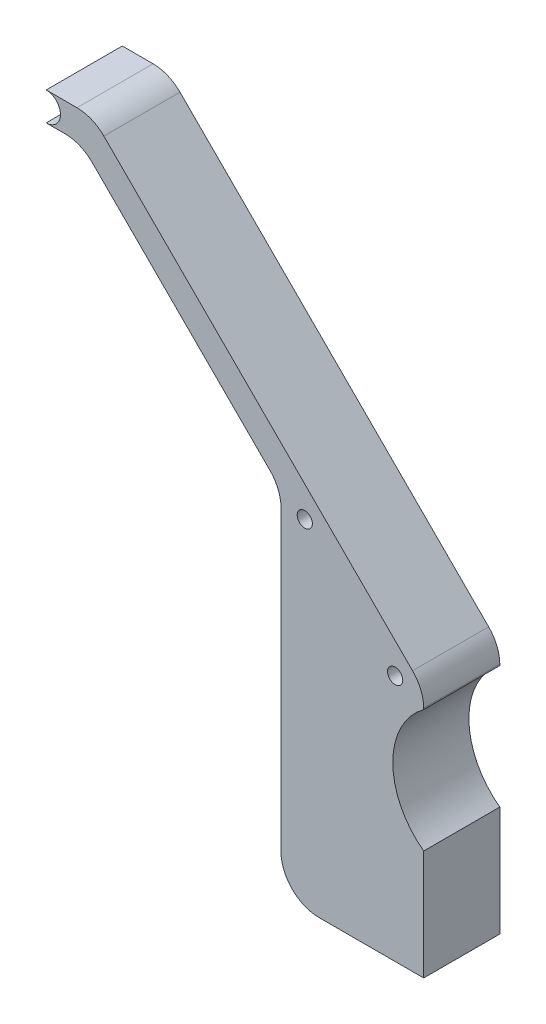
from build123d import *

# Parameters (mm, degrees)
EXTRUDE_618_DEPTH   = 8
HOLE_WIZARD_M2_D    = 1.6
SKETCH_5_W          = 15
SKETCH_5_H          = 23
EXTRUDE_1905_DEPTH  = 8
FILLET_1_R          = 4
CUT_EXTRUDE_1_DEPTH = 60.03470161


with BuildPart() as part:
    # Эскиз1 → Extrude 618 (new body)
    with BuildSketch(Plane.XY):
        with BuildLine():
            Line((0.03033425, 5), (-14.96966575, 5))
            Line((-14.96966575, 5), (-14.96966575, 18.96966575))
            Line((-14.96966575, 18.96966575), (-36, 40))
            Line((-36, 40), (-39.64966575, 40))
            ThreePointArc((-39.64966575, 40), (-38.14966575, 41.5), (-39.64966575, 43))
            Line((-39.64966575, 43), (-34.757359313, 43))
            Line((-34.757359313, 43), (0.03033425, 8.212306438))
            Line((0.03033425, 8.212306438), (0.03033425, 5))
        make_face()
    extrude(amount=-EXTRUDE_618_DEPTH)

    # Крепление M2 (through all)
    with Locations(Plane.XY):
        with Locations((-2.96966575, 8), (-12.46966575, 17.5)):
            Hole(HOLE_WIZARD_M2_D / 2)

    # Эскиз5 → Extrude 1905 (add)
    with BuildSketch(Plane.XY):
        with Locations((-7.46966575, -6.5)):
            Rectangle(SKETCH_5_W, SKETCH_5_H)
    extrude(amount=-EXTRUDE_1905_DEPTH)

    # Скругление1
    fillet_1_edges = [part.edges().sort_by_distance(p)[0] for p in [
        (-14.96966575, 18.96966575, -4),
        (-36, 40, -4),
        (-34.757359313, 43, -4),
        (0.03033425, 8.212306438, -4),
        (-14.96966575, -18, -4),
    ]]
    fillet(fillet_1_edges, radius=FILLET_1_R)

    # Эскиз6 → Вырез-Вытянуть1 (cut, through all)
    with BuildSketch(Plane.XY):
        with BuildLine():
            Line((0.03033425, 6.437196595), (0.03033425, -6.437196595))
            ThreePointArc((0.03033425, -6.437196595), (-3.21966575, 0), (0.03033425, 6.437196595))
        make_face()
    extrude(amount=-CUT_EXTRUDE_1_DEPTH, mode=Mode.SUBTRACT)


solid = part.part
